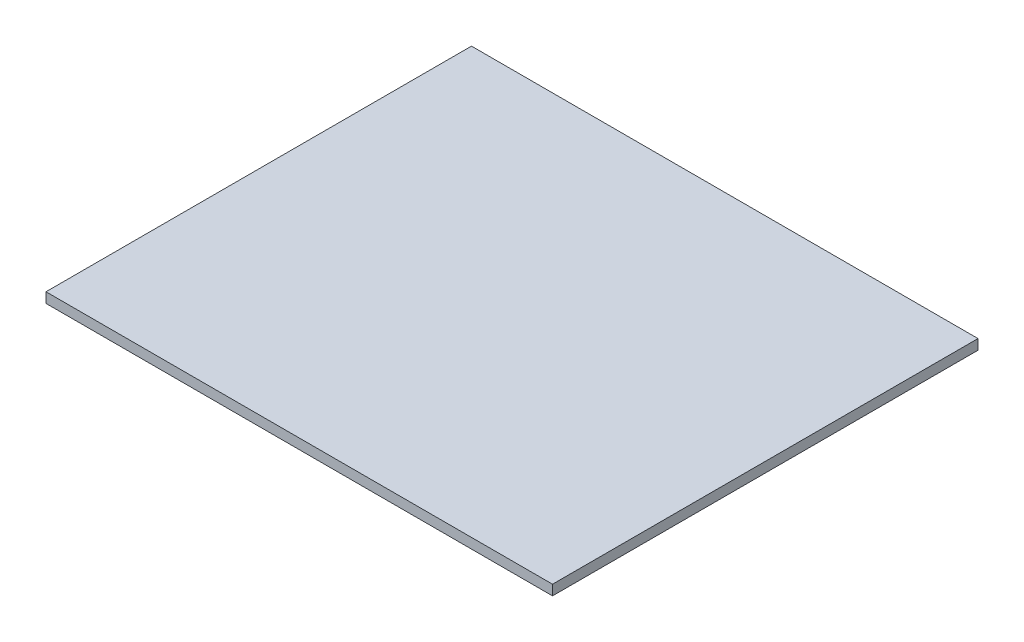
from build123d import *

# Parameters (mm, degrees)
SKETCH1_W           = 2500
SKETCH1_H           = 2100
BOSS_EXTRUDE1_DEPTH = 50
SKETCH2_W           = 750
SKETCH2_H           = 750
CUT_EXTRUDE1_DEPTH  = 10


with BuildPart() as part:
    # Sketch1 → Boss-Extrude1 (new body)
    with BuildSketch(Plane(origin=(0, 0, 0), x_dir=(1, 0, 0), z_dir=(0, 1, 0))):
        Rectangle(SKETCH1_W, SKETCH1_H)
    extrude(amount=BOSS_EXTRUDE1_DEPTH)

    # Sketch2 → Cut-Extrude1 (cut)
    with BuildSketch(Plane.XZ):
        Rectangle(SKETCH2_W, SKETCH2_H)
    extrude(amount=-CUT_EXTRUDE1_DEPTH, mode=Mode.SUBTRACT)


solid = part.part
